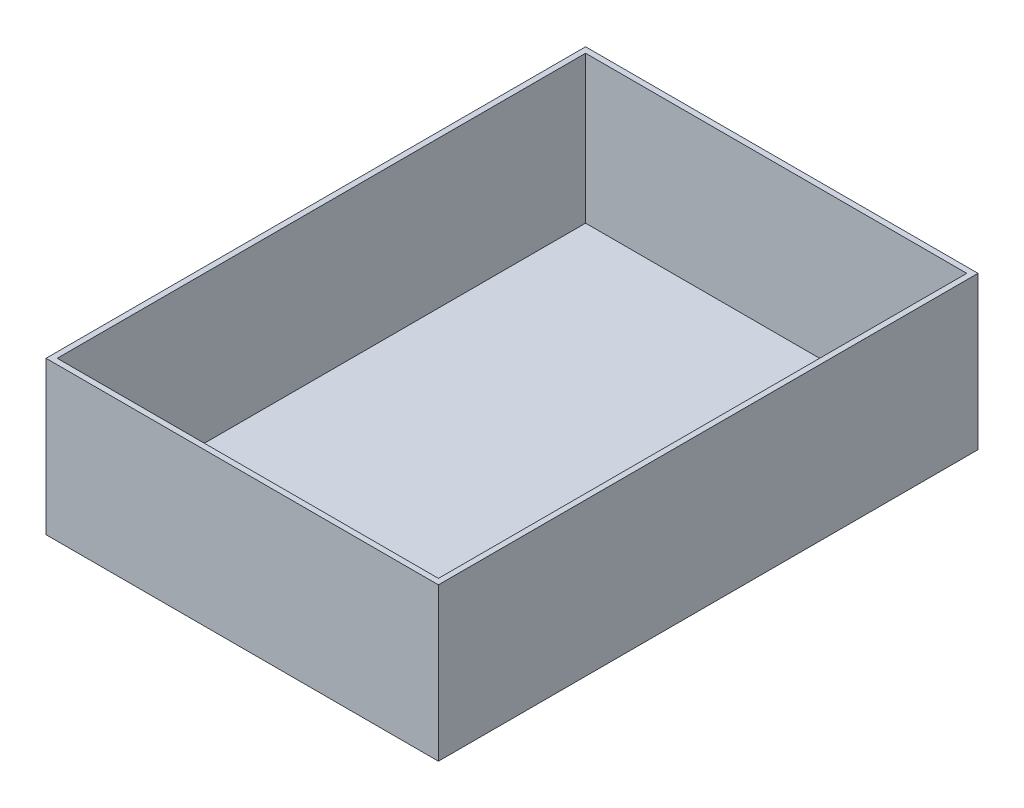
from build123d import *

# Parameters (mm, degrees)
SKETCH_1_W      = 56
SKETCH_1_H      = 77
EXTRUDE_1_DEPTH = 21.8
SHELL_1_T       = -0.8


with BuildPart() as part:
    # 草图1 → 凸台-拉伸1 (new body)
    with BuildSketch(Plane(origin=(0, 0, 0), x_dir=(1, 0, 0), z_dir=(0, 1, 0))):
        Rectangle(SKETCH_1_W, SKETCH_1_H)
    extrude(amount=EXTRUDE_1_DEPTH)

    # 抽壳1
    shell_1_openings = [part.faces().sort_by_distance(p)[0] for p in [
        (0, 21.8, 0),
    ]]
    offset(amount=SHELL_1_T, openings=shell_1_openings, kind=Kind.INTERSECTION)


solid = part.part
